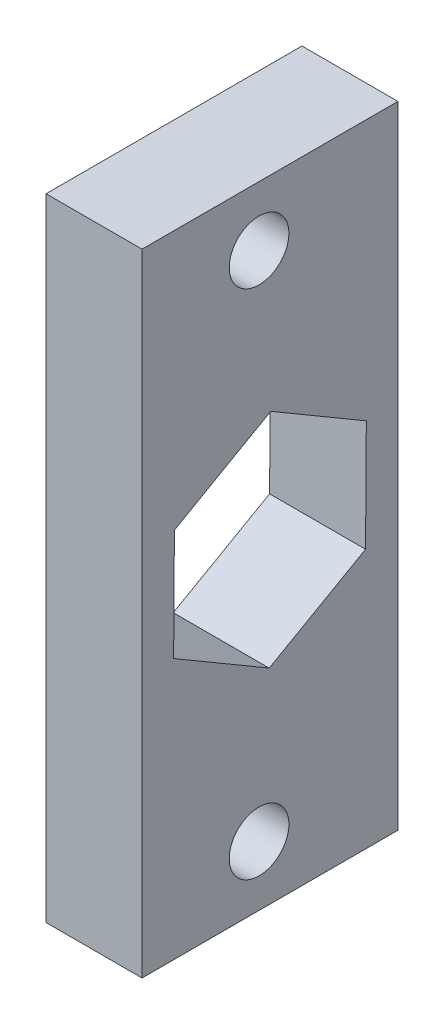
from build123d import *

# Parameters (mm, degrees)
SKETCH1_W           = 39.466666666
SKETCH1_H           = 16
SKETCH1_R           = 1.866666667
BOSS_EXTRUDE1_DEPTH = 6


with BuildPart() as part:
    # Sketch1 → Boss-Extrude1 (new body)
    with BuildSketch(Plane(origin=(0, 0, 0), x_dir=(0, -1, 0), z_dir=(1, 0, 0))):
        with Locations((0.004714435, 11.349547327)):
            Rectangle(SKETCH1_W, SKETCH1_H)
        with Locations(Location((16, 10.666666667, 0), (0, 0, 90))):
            Circle(SKETCH1_R, mode=Mode.SUBTRACT)
        with Locations(Location((-16, 10.666666667, 0), (0, 0, 90))):
            Circle(SKETCH1_R, mode=Mode.SUBTRACT)
        Polygon((-3.417883139, 17.373319057), (-6.923323696, 11.397376747), (-3.500726123, 5.373605017), (3.427312009, 5.325775598), (6.932752566, 11.301717908), (3.510154993, 17.325489638), align=None, mode=Mode.SUBTRACT)
    extrude(amount=BOSS_EXTRUDE1_DEPTH)


solid = part.part
